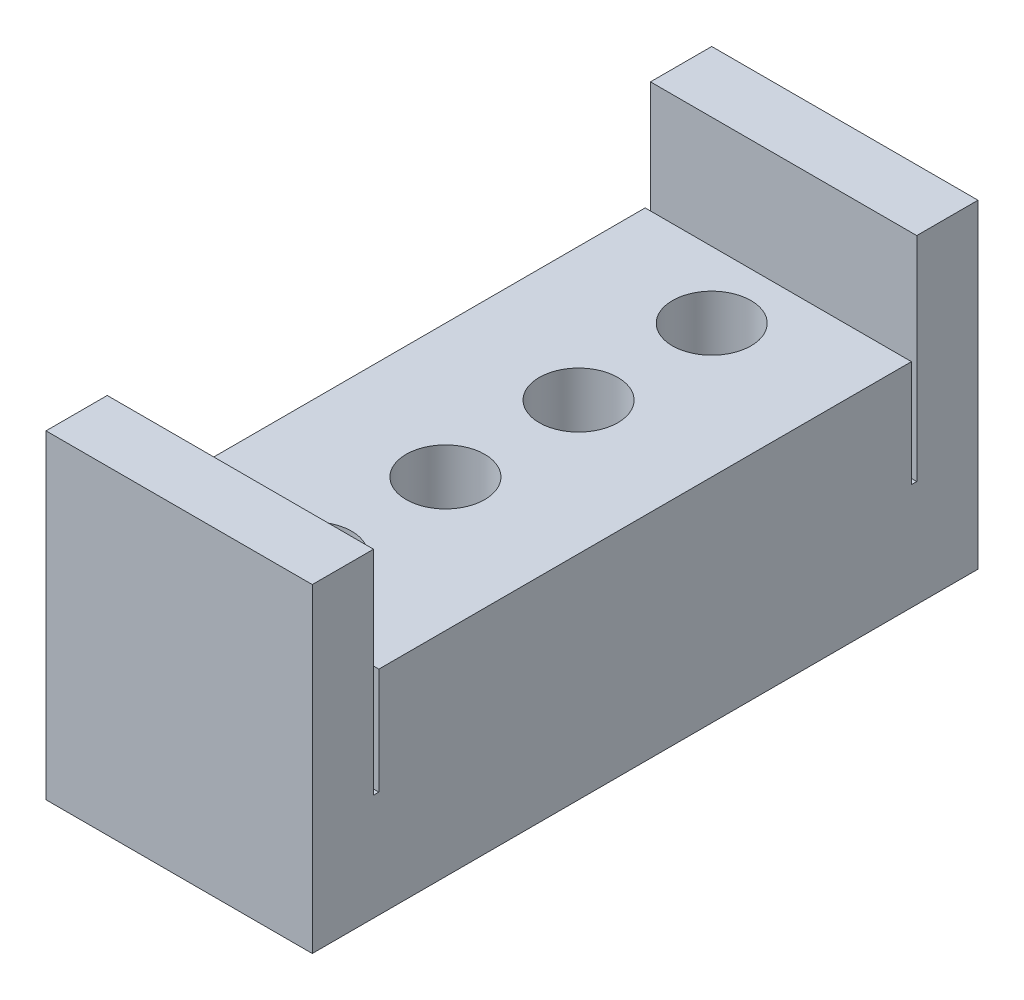
from build123d import *

# Parameters (mm, degrees)
SKETCH1_W           = 10
SKETCH1_H           = 25
BOSS_EXTRUDE1_DEPTH = 8
SKETCH8_W           = 10
SKETCH8_H           = 2.3
BOSS_EXTRUDE4_DEPTH = 4
SKETCH9_W           = 10
SKETCH9_H           = 0.2
CUT_EXTRUDE3_DEPTH  = 4
SKETCH4_R           = 1.475
CUT_EXTRUDE2_DEPTH  = 8
LPATTERN1_COUNT     = 4
LPATTERN1_PITCH     = 5


with BuildPart() as part:
    # Sketch1 → Boss-Extrude1 (new body)
    with BuildSketch(Plane(origin=(0, 0, 0), x_dir=(1, 0, 0), z_dir=(0, 1, 0))):
        Rectangle(SKETCH1_W, SKETCH1_H)
    extrude(amount=BOSS_EXTRUDE1_DEPTH)

    # Sketch8 → Boss-Extrude4 (add)
    with BuildSketch(Plane(origin=(0, 8, 0), x_dir=(1, 0, 0), z_dir=(0, 1, 0))):
        with Locations((0, 11.35)):
            Rectangle(SKETCH8_W, SKETCH8_H)
        with Locations((0, -11.35)):
            Rectangle(SKETCH8_W, SKETCH8_H)
    extrude(amount=BOSS_EXTRUDE4_DEPTH)

    # Sketch9 → Cut-Extrude3 (cut)
    with BuildSketch(Plane(origin=(0, 8, 0), x_dir=(1, 0, 0), z_dir=(0, 1, 0))):
        with Locations((0, 10.1)):
            Rectangle(SKETCH9_W, SKETCH9_H)
        with Locations((0, -10.1)):
            Rectangle(SKETCH9_W, SKETCH9_H)
    extrude(amount=-CUT_EXTRUDE3_DEPTH, mode=Mode.SUBTRACT)

    # Sketch4 → Cut-Extrude2 (cut)
    with BuildSketch(Plane.XZ):
        with Locations(Location((0, 7.5, 0), (0, 0, 270))):
            Circle(SKETCH4_R)
    cut_extrude2 = extrude(amount=-CUT_EXTRUDE2_DEPTH, mode=Mode.SUBTRACT)

    # LPattern1: Cut-Extrude2 ×4
    with Locations(*[(0, 0, -i * LPATTERN1_PITCH) for i in range(1, LPATTERN1_COUNT)]):
        add(cut_extrude2, mode=Mode.SUBTRACT)


solid = part.part
